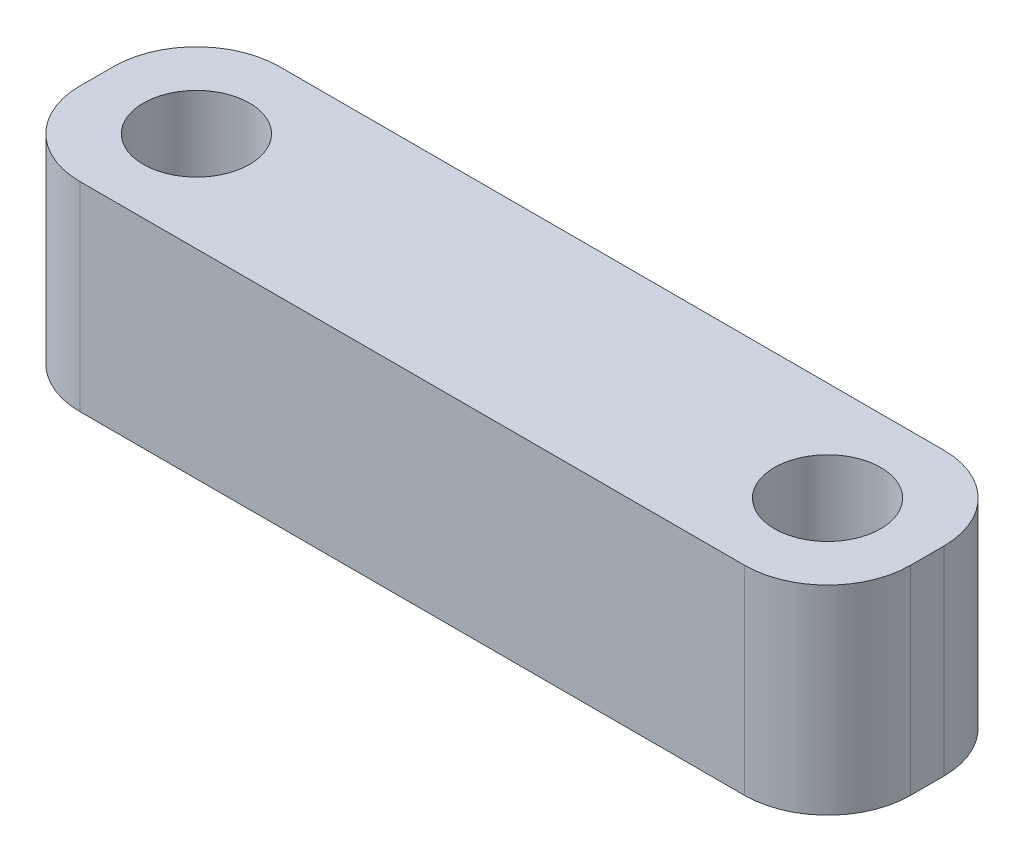
from build123d import *

# Parameters (mm, degrees)
SKETCH1_W           = 25
SKETCH1_H           = 6
BOSS_EXTRUDE1_DEPTH = 3
SKETCH2_R           = 1.6
CUT_EXTRUDE1_DEPTH  = 15.186260959
FILLET1_R           = 2.5


with BuildPart() as part:
    # Sketch1 → Boss-Extrude1 (new, symmetric)
    with BuildSketch(Plane(origin=(0, 0, 0), x_dir=(1, 0, 0), z_dir=(0, 1, 0))):
        Rectangle(SKETCH1_W, SKETCH1_H)
    extrude(amount=BOSS_EXTRUDE1_DEPTH, both=True)

    # Sketch2 → Cut-Extrude1 (cut, through all)
    with BuildSketch(Plane(origin=(0, 3, 0), x_dir=(1, 0, 0), z_dir=(0, 1, 0))):
        with Locations(Location((9.5, 0, 0), (0, 0, 270))):
            Circle(SKETCH2_R)
        with Locations(Location((-9.5, 0, 0), (0, 0, 270))):
            Circle(SKETCH2_R)
    extrude(amount=-CUT_EXTRUDE1_DEPTH, mode=Mode.SUBTRACT)

    # Fillet1
    fillet1_edges = [part.edges().sort_by_distance(p)[0] for p in [
        (12.5, 0, 3),
        (-12.5, 0, 3),
        (-12.5, 0, -3),
        (12.5, 0, -3),
    ]]
    fillet(fillet1_edges, radius=FILLET1_R)


solid = part.part
